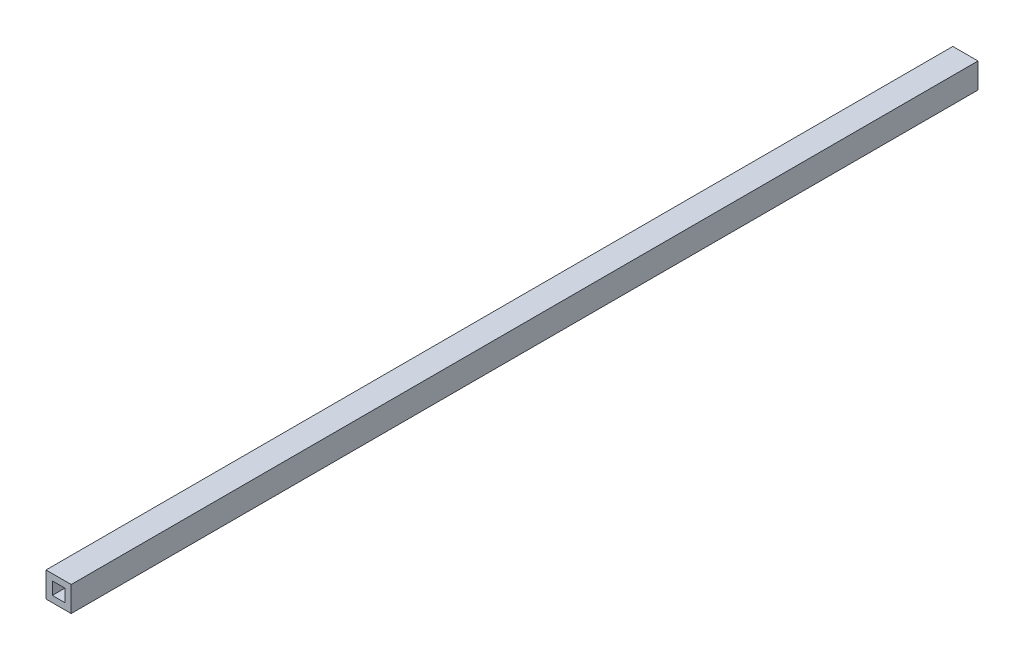
from build123d import *

# Parameters (mm, degrees)
SKETCH1_W           = 914.4
SKETCH1_H           = 25.4
BOSS_EXTRUDE1_DEPTH = 25.4
SKETCH2_W           = 12.7
SKETCH2_H           = 12.7
CUT_EXTRUDE1_DEPTH  = 915.840865943


with BuildPart() as part:
    # Sketch1 → Boss-Extrude1 (new body)
    with BuildSketch(Plane(origin=(0, 0, 0), x_dir=(0, 0, -1), z_dir=(1, 0, 0))):
        Rectangle(SKETCH1_W, SKETCH1_H)
    extrude(amount=BOSS_EXTRUDE1_DEPTH)

    # Sketch2 → Cut-Extrude1 (cut, through all)
    with BuildSketch(Plane.XY.offset(457.2)):
        with Locations((12.7, 0)):
            Rectangle(SKETCH2_W, SKETCH2_H)
    extrude(amount=-CUT_EXTRUDE1_DEPTH, mode=Mode.SUBTRACT)


solid = part.part
